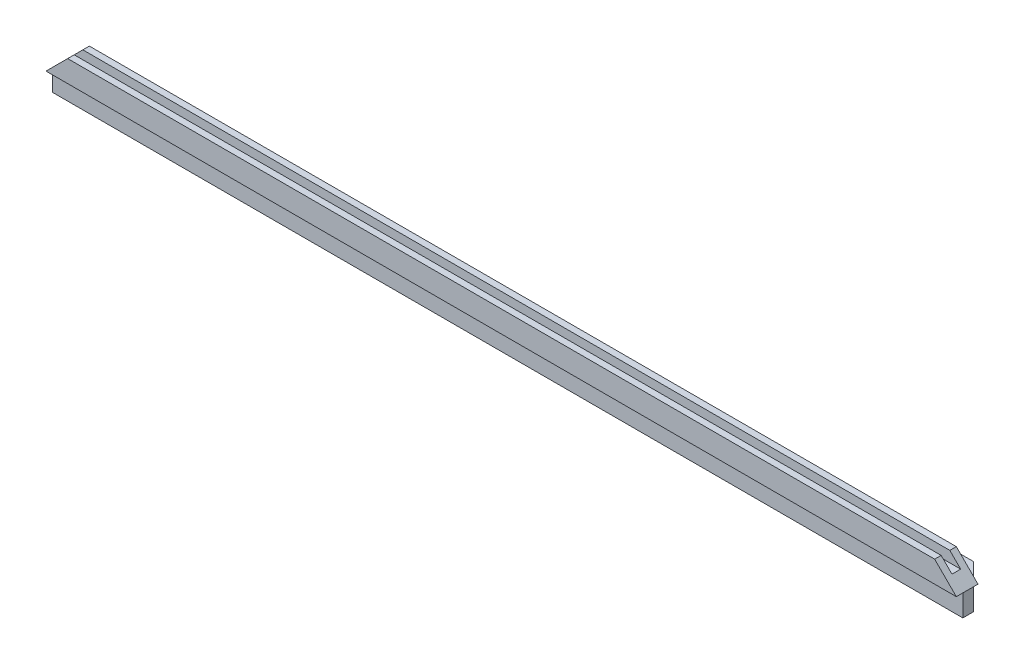
from build123d import *

# Parameters (mm, degrees)
EXTRUDE_2_DEPTH = 4
EXTRUDE_3_DEPTH = 3
SKETCH_5_W      = 420
SKETCH_5_H      = 10
EXTRUDE_4_DEPTH = 5
EXTRUDE_5_DEPTH = 4
EXTRUDE_6_DEPTH = 3


with BuildPart() as part:
    # 草图2 → 凸台-拉伸2 (new body)
    with BuildSketch(Plane(origin=(0, 0, 0), x_dir=(1, 0, 0), z_dir=(0, 1, 0))):
        Polygon((-130.641446974, -36.925945051), (289.358553026, -36.925945051), (284.358553026, -31.925945051), (-125.641446974, -31.925945051), align=None)
    extrude(amount=EXTRUDE_2_DEPTH)

    # 草图3 → 凸台-拉伸3 (add)
    with BuildSketch(Plane(origin=(0, 4, 0), x_dir=(1, 0, 0), z_dir=(0, 1, 0))):
        Polygon((-130.641446974, -36.925945051), (-120.641446974, -26.925945051), (279.358553026, -26.925945051), (289.358553026, -36.925945051), align=None)
    extrude_3 = extrude(amount=EXTRUDE_3_DEPTH)

    # 镜向1: 凸台-拉伸3 across plane
    add(extrude_3.mirror(Plane.ZX.offset(2)))

    # 草图5 → 凸台-拉伸4 (add)
    with BuildSketch(Plane.XY.offset(36.925945051)):
        with Locations((79.358553026, 2)):
            Rectangle(SKETCH_5_W, SKETCH_5_H)
    extrude(amount=EXTRUDE_4_DEPTH)

    # 草图7 → 凸台-拉伸5 (add)
    with BuildSketch(Plane.XY.offset(41.925945051)):
        Polygon((-130.641446974, 7), (289.358553026, 7), (284.358553026, 12), (-125.641446974, 12), align=None)
    extrude(amount=-EXTRUDE_5_DEPTH)

    # 草图8 → 凸台-拉伸6 (add)
    with BuildSketch(Plane(origin=(0, 0, 37.925945051), x_dir=(-1, 0, 0), z_dir=(0, 0, -1))):
        Polygon((-289.358553026, 7), (-279.358553026, 17), (120.641446974, 17), (130.641446974, 7), align=None)
    extrude_6 = extrude(amount=EXTRUDE_6_DEPTH)

    # 镜向2: 凸台-拉伸6 across plane
    add(extrude_6.mirror(Plane(origin=(0, 0, 39.925945051), x_dir=(1, 0, 0), z_dir=(0, 0, -1))))


solid = part.part
